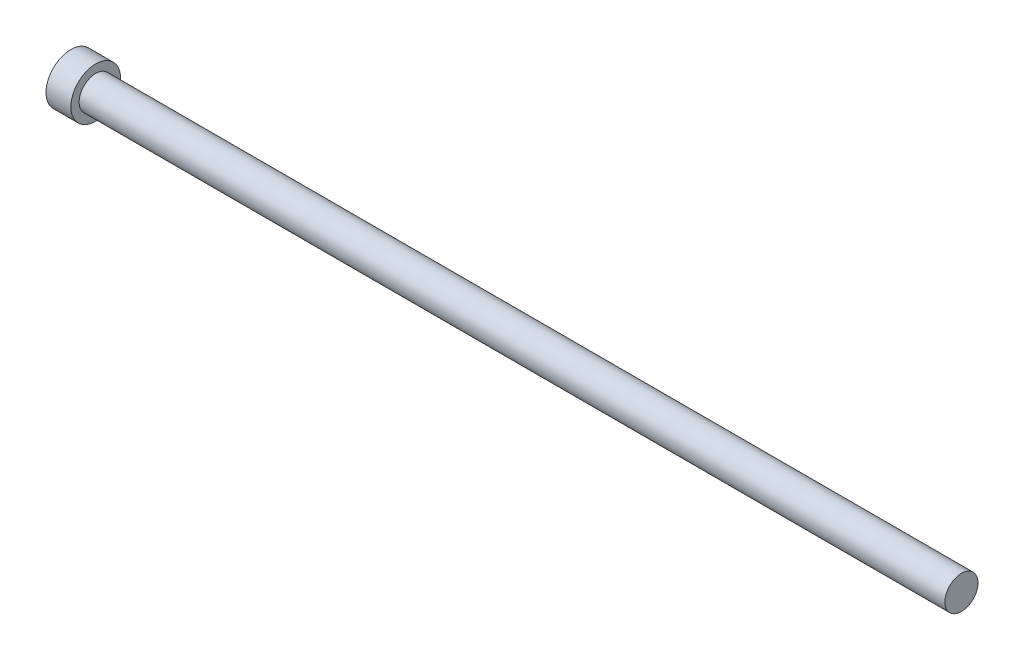
from build123d import *


with BuildPart() as part:
    # Sketch1 → Revolve1 (revolve)
    with BuildSketch(Plane.XY, mode=Mode.PRIVATE) as revolve1_sk:
        Polygon((0, 0), (215, 0), (215, 4), (6, 4), (6, 6), (0, 6), align=None)
    revolve(revolve1_sk.sketch.rotate(Axis((0, 0, 0), (1, 0, 0)), 90), axis=Axis((0, 0, 0), (1, 0, 0)))


solid = part.part
